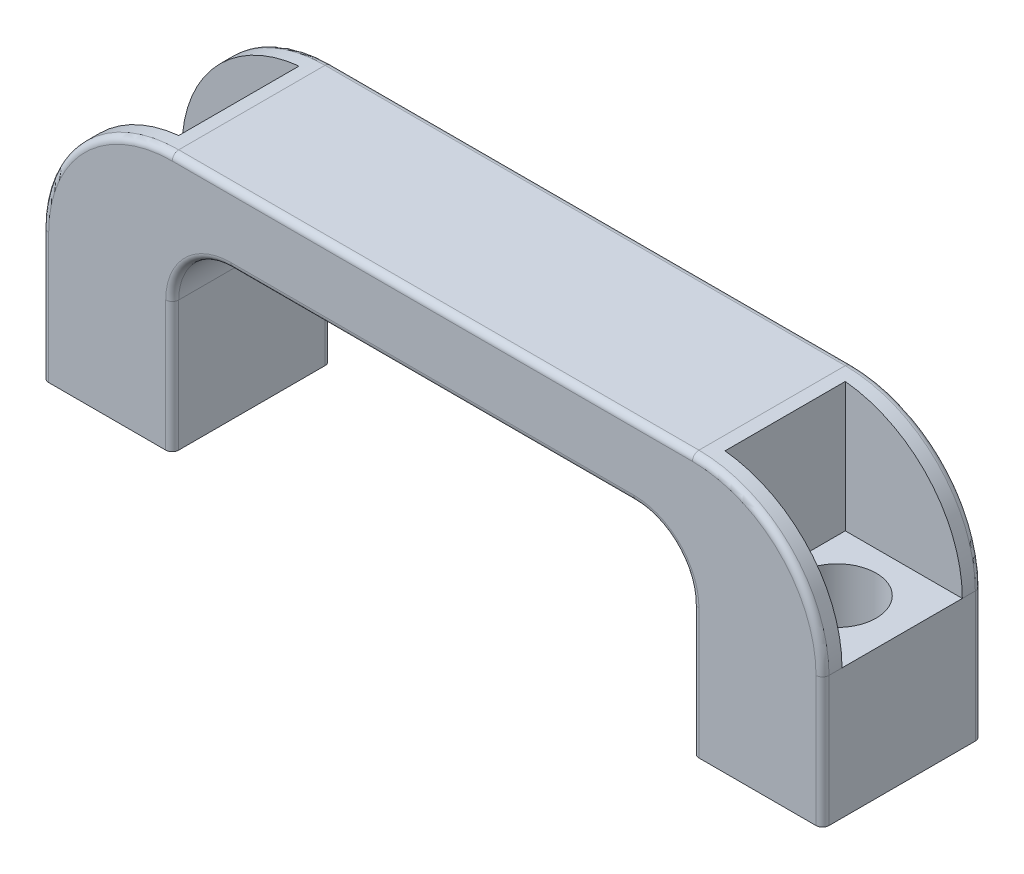
from build123d import *

# Parameters (mm, degrees)
EXTRUDE_1_DEPTH     = 24.5
FILLET_1_R          = 20
FILLET_2_R          = 9
SKETCH_2_W          = 18.5
SKETCH_2_H          = 26.060105981
CUT_EXTRUDE_1_DEPTH = 18
SKETCH_3_W          = 18.5
SKETCH_3_H          = 21.487076152
CUT_EXTRUDE_2_DEPTH = 18
FILLET_3_R          = 1
SKETCH_6_R          = 4
SKETCH_6_R_2        = 3.25
CUT_EXTRUDE_3_DEPTH = 129.841957452
SKETCH_7_R          = 6
CUT_EXTRUDE_4_DEPTH = 10
SKETCH_8_R          = 3.5
CUT_EXTRUDE_5_DEPTH = 127.09619344
EXTRUDE_START       = -10
SKETCH_9_R          = 4
SKETCH_9_R_2        = 3.5
EXTRUDE_2_DEPTH     = 10


with BuildPart() as part:
    # Эскиз1 → Бобышка-Вытянуть1 (new body)
    with BuildSketch(Plane.XY):
        Polygon((0, 0), (0, 40), (120, 40), (120, 0), (100, 0), (100, 29), (20, 29), (20, 0), align=None)
    extrude(amount=EXTRUDE_1_DEPTH)

    # Скругление1
    fillet_1_edges = [part.edges().sort_by_distance(p)[0] for p in [
        (0, 40, 12.25),
        (120, 40, 12.25),
    ]]
    fillet(fillet_1_edges, radius=FILLET_1_R)

    # Скругление2
    fillet_2_edges = [part.edges().sort_by_distance(p)[0] for p in [
        (100, 29, 12.25),
        (20, 29, 12.25),
    ]]
    fillet(fillet_2_edges, radius=FILLET_2_R)

    # Эскиз2 → Вырез-Вытянуть1 (cut)
    with BuildSketch(Plane(origin=(120, 0, 0), x_dir=(0, 0, -1), z_dir=(1, 0, 0))):
        with Locations((-12.25, 33.03005299)):
            Rectangle(SKETCH_2_W, SKETCH_2_H)
    extrude(amount=-CUT_EXTRUDE_1_DEPTH, mode=Mode.SUBTRACT)

    # Эскиз3 → Вырез-Вытянуть2 (cut)
    with BuildSketch(Plane.ZY):
        with Locations((12.25, 30.743538076)):
            Rectangle(SKETCH_3_W, SKETCH_3_H)
    extrude(amount=-CUT_EXTRUDE_2_DEPTH, mode=Mode.SUBTRACT)

    # Скругление3
    fillet_3_edges = [part.edges().sort_by_distance(p)[0] for p in [
        (20, 10, 0),
        (120, 10, 24.5),
        (0, 10, 0),
        (0, 10, 24.5),
        (60, 40, 0),
        (114.142135624, 34.142135624, 0),
        (5.857864376, 34.142135624, 0),
        (60, 40, 24.5),
        (114.142135624, 34.142135624, 24.5),
        (5.857864376, 34.142135624, 24.5),
        (60, 29, 0),
        (60, 29, 24.5),
        (100, 10, 0),
        (100, 10, 24.5),
        (22.636038969, 26.363961031, 0),
        (22.636038969, 26.363961031, 24.5),
        (97.363961031, 26.363961031, 0),
        (97.363961031, 26.363961031, 24.5),
        (20, 10, 24.5),
        (120, 10, 0),
    ]]
    fillet(fillet_3_edges, radius=FILLET_3_R)

    # Эскиз6 → Вырез-Вытянуть3 (cut, through all)
    with BuildSketch(Plane(origin=(0, 0, 0), x_dir=(-1, 0, 0), z_dir=(0, -1, 0))):
        with Locations(Location((-10, -12.25, 0), (0, 0, 180))):
            Circle(SKETCH_6_R)
        with Locations(Location((-110, -12.25, 0), (0, 0, 180))):
            Circle(SKETCH_6_R_2)
    extrude(amount=-CUT_EXTRUDE_3_DEPTH, mode=Mode.SUBTRACT)

    # Эскиз7 → Вырез-Вытянуть4 (cut)
    with BuildSketch(Plane(origin=(0, 20, 0), x_dir=(1, 0, 0), z_dir=(0, 1, 0))):
        with Locations(Location((10, -12.25, 0), (0, 0, 270))):
            Circle(SKETCH_7_R)
        with Locations(Location((110, -12.25, 0), (0, 0, 270))):
            Circle(SKETCH_7_R)
    extrude(amount=-CUT_EXTRUDE_4_DEPTH, mode=Mode.SUBTRACT)

    # Эскиз8 → Вырез-Вытянуть5 (cut, through all)
    with BuildSketch(Plane(origin=(0, 10, 0), x_dir=(1, 0, 0), z_dir=(0, 1, 0))):
        with Locations(Location((110, -12.25, 0), (0, 0, 270))):
            Circle(SKETCH_8_R)
    extrude(amount=-CUT_EXTRUDE_5_DEPTH, mode=Mode.SUBTRACT)

    # Эскиз9 → Бобышка-Вытянуть2 (add)
    with BuildSketch(Plane(origin=(0, 10, 0), x_dir=(1, 0, 0), z_dir=(0, 1, 0)).offset(EXTRUDE_START)):
        with Locations((10, -12.25)):
            Circle(SKETCH_9_R)
        with Locations(Location((10, -12.25, 0), (0, 0, 270))):
            Circle(SKETCH_9_R_2, mode=Mode.SUBTRACT)
    extrude(amount=EXTRUDE_2_DEPTH)


solid = part.part
